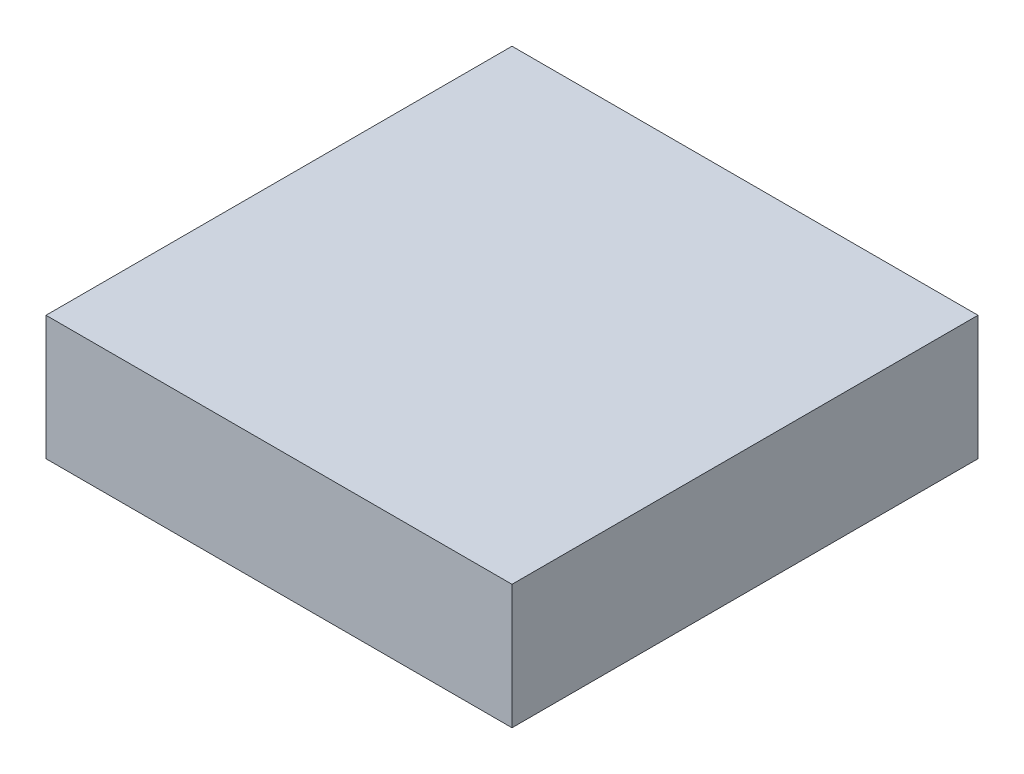
from build123d import *

# Parameters (mm, degrees)
SKETCH1_W           = 30
SKETCH1_H           = 30
BOSS_EXTRUDE1_DEPTH = 8


with BuildPart() as part:
    # Sketch1 → Boss-Extrude1 (new body)
    with BuildSketch(Plane(origin=(0, 0, 0), x_dir=(1, 0, 0), z_dir=(0, 1, 0))):
        Rectangle(SKETCH1_W, SKETCH1_H)
    extrude(amount=BOSS_EXTRUDE1_DEPTH)


solid = part.part
